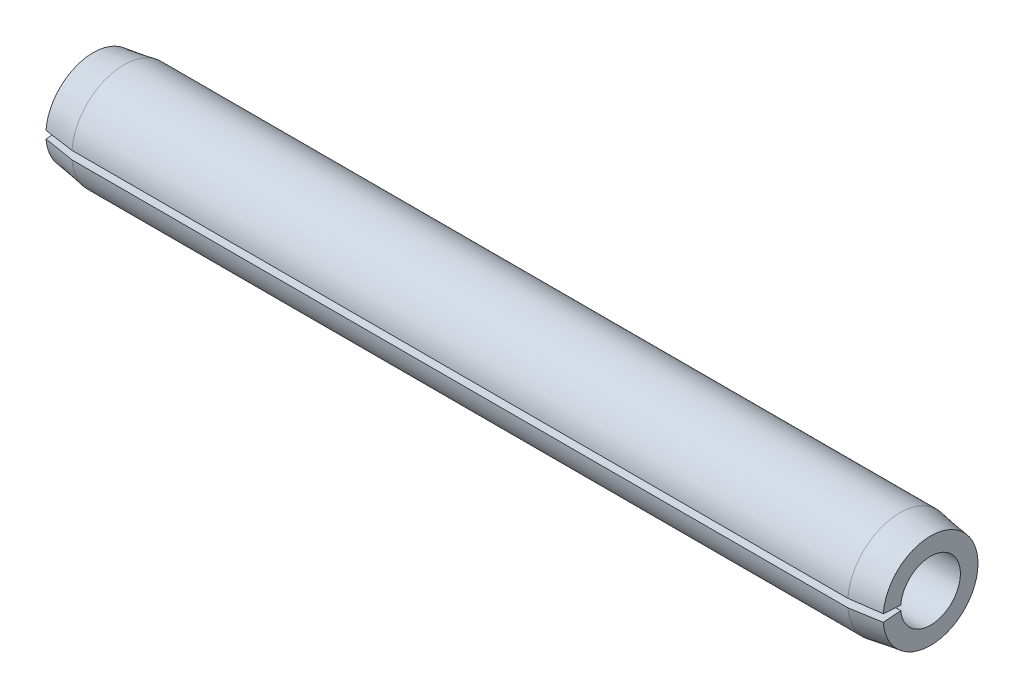
from build123d import *

# Parameters (mm, degrees)
GAP_DEPTH = 39.247748954


with BuildPart() as part:
    # Sketch1 → Base-Revolve (revolve)
    with BuildSketch(Plane.XY, mode=Mode.PRIVATE) as base_revolve_sk:
        Polygon((0, 1.3589), (38.1, 1.3589), (38.1, 2.159), (36.703, 2.3749), (1.397, 2.3749), (0, 2.159), align=None)
    revolve(base_revolve_sk.sketch.rotate(Axis((-9.525, 0, 0), (1, 0, 0)), 90), axis=Axis((-9.525, 0, 0), (1, 0, 0)))

    # Sketch2 → Gap (cut, through all)
    with BuildSketch(Plane(origin=(0, 0, 0), x_dir=(0, -1, 0), z_dir=(-1, 0, 0))):
        with BuildLine():
            Line((0, 0), (0.190059157, 2.414930555))
            ThreePointArc((0.190059157, 2.414930555), (0, 2.422398), (-0.190059157, 2.414930555))
            Line((-0.190059157, 2.414930555), (0, 0))
        make_face()
    extrude(amount=-GAP_DEPTH, mode=Mode.SUBTRACT)


solid = part.part
